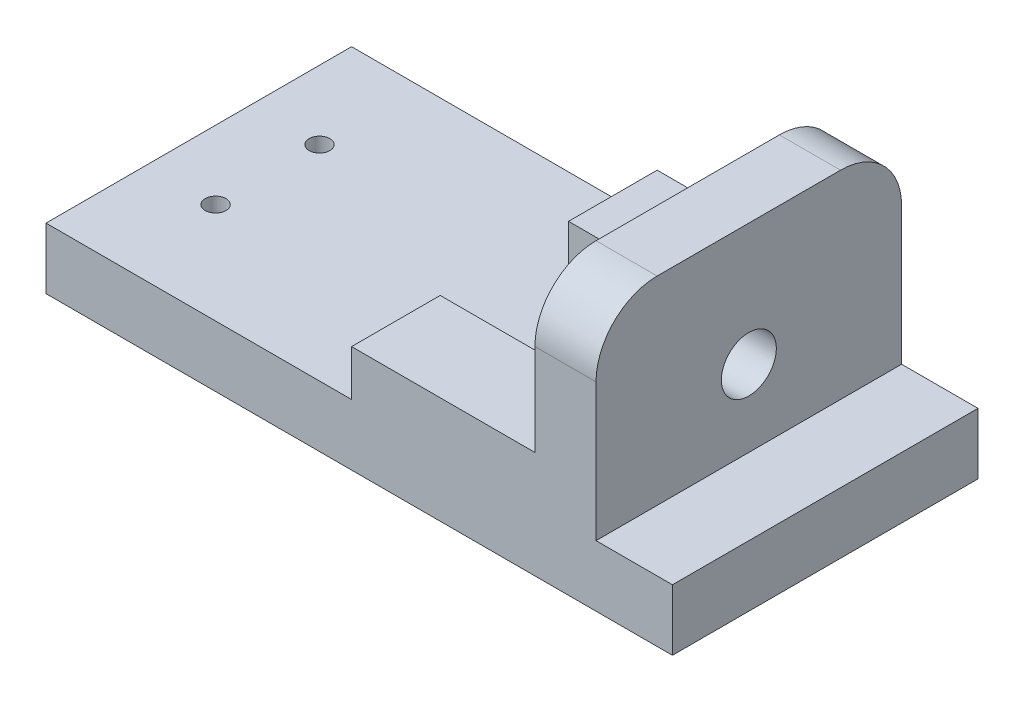
from build123d import *

# Parameters (mm, degrees)
SKETCH1_W                  = 205
SKETCH1_H                  = 100
BOSS_EXTRUDE1_DEPTH        = 20
M8_TAPPED_HOLE1_D          = 6.8
SKETCH11_W                 = 20
SKETCH11_H                 = 100
BOSS_EXTRUDE4_DEPTH        = 65
SKETCH12_W                 = 60
SKETCH12_H                 = 29
BOSS_EXTRUDE5_DEPTH        = 15
FILLET2_R                  = 20
F_18_0_18_DIAMETER_HOLE2_D = 18


with BuildPart() as part:
    # Sketch1 → Boss-Extrude1 (new body)
    with BuildSketch(Plane(origin=(0, 0, 0), x_dir=(1, 0, 0), z_dir=(0, 1, 0))):
        with Locations((102.5, 50)):
            Rectangle(SKETCH1_W, SKETCH1_H)
    extrude(amount=BOSS_EXTRUDE1_DEPTH)

    # M8 Tapped Hole1 (through all)
    with Locations(Plane(origin=(22.5, 20, -33), x_dir=(0, 0, 1), z_dir=(0, 1, 0))):
        with Locations((0, 0), (-34, 0)):
            Hole(M8_TAPPED_HOLE1_D / 2)

    # Sketch11 → Boss-Extrude4 (add)
    with BuildSketch(Plane(origin=(0, 20, 0), x_dir=(1, 0, 0), z_dir=(0, 1, 0))):
        with Locations((170, 50)):
            Rectangle(SKETCH11_W, SKETCH11_H)
    extrude(amount=BOSS_EXTRUDE4_DEPTH)

    # Sketch12 → Boss-Extrude5 (add)
    with BuildSketch(Plane(origin=(0, 20, 0), x_dir=(1, 0, 0), z_dir=(0, 1, 0))):
        with Locations((130, 14.5)):
            Rectangle(SKETCH12_W, SKETCH12_H)
        with Locations((130, 85.5)):
            Rectangle(SKETCH12_W, SKETCH12_H)
    extrude(amount=BOSS_EXTRUDE5_DEPTH)

    # Fillet2
    fillet2_edges = [part.edges().sort_by_distance(p)[0] for p in [
        (170, 85, 0),
        (170, 85, -100),
    ]]
    fillet(fillet2_edges, radius=FILLET2_R)

    # Ø18.0 (18) Diameter Hole2 (through all)
    with Locations(Plane.ZY.offset(-160)):
        with Locations((-50, 45)):
            Hole(F_18_0_18_DIAMETER_HOLE2_D / 2)


solid = part.part
